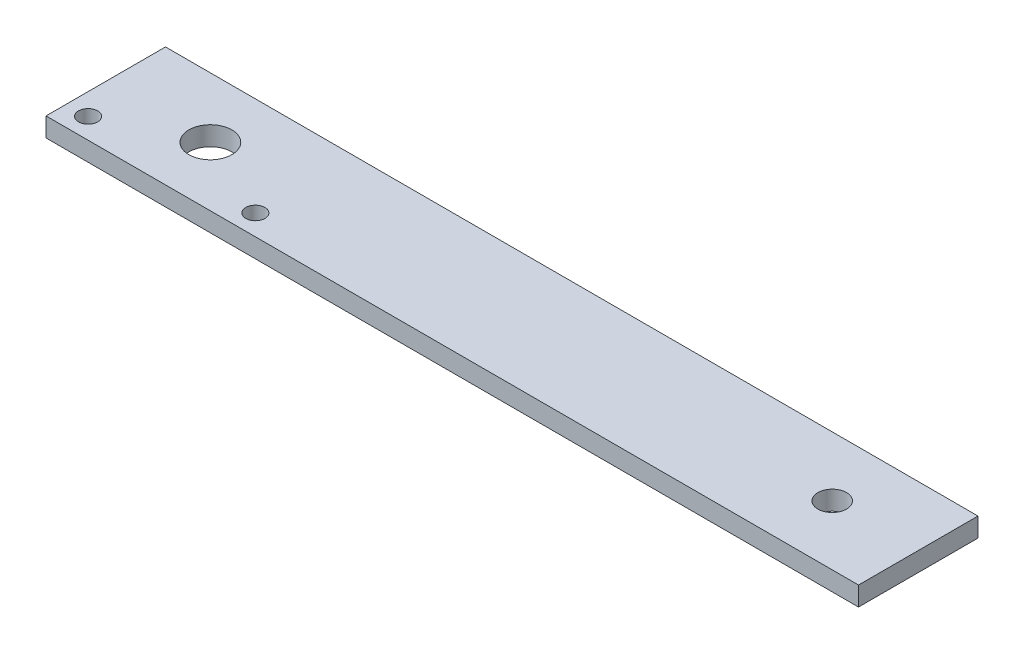
from build123d import *

# Parameters (mm, degrees)
SKETCH1_W           = 170
SKETCH1_H           = 25
SKETCH1_R           = 4.5
SKETCH1_R_2         = 2
SKETCH1_R_3         = 3
BOSS_EXTRUDE1_DEPTH = 4


with BuildPart() as part:
    # Sketch1 → Boss-Extrude1 (new body)
    with BuildSketch(Plane(origin=(0, 0, 0), x_dir=(1, 0, 0), z_dir=(0, 1, 0))):
        Rectangle(SKETCH1_W, SKETCH1_H)
        with Locations(Location((-63.031156016, -0.080201784, 0), (0, 0, 270))):
            Circle(SKETCH1_R, mode=Mode.SUBTRACT)
        with Locations(Location((-80.509495504, -8.182745221, 0), (0, 0, 270))):
            Circle(SKETCH1_R_2, mode=Mode.SUBTRACT)
        with Locations(Location((-45.509495504, -8.182745221, 0), (0, 0, 270))):
            Circle(SKETCH1_R_2, mode=Mode.SUBTRACT)
        with Locations(Location((67, 0, 0), (0, 0, 270))):
            Circle(SKETCH1_R_3, mode=Mode.SUBTRACT)
    extrude(amount=BOSS_EXTRUDE1_DEPTH)


solid = part.part
